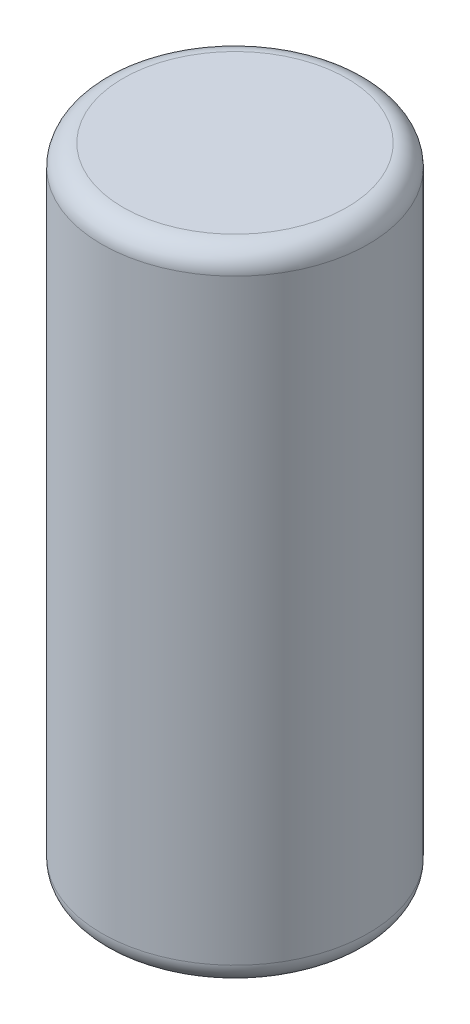
from build123d import *

# Parameters (mm, degrees)
SKETCH1_R           = 62.5
BOSS_EXTRUDE1_DEPTH = 300
FILLET3_R           = 10


with BuildPart() as part:
    # Sketch1 → Boss-Extrude1 (new body)
    with BuildSketch(Plane(origin=(0, 0, 0), x_dir=(1, 0, 0), z_dir=(0, 1, 0))):
        with Locations(Location((0, 0, 0), (0, 0, 270))):
            Circle(SKETCH1_R)
    extrude(amount=BOSS_EXTRUDE1_DEPTH)

    # Fillet3
    fillet3_edges = [part.edges().sort_by_distance(p)[0] for p in [
        (0, 0, -62.5),
        (0, 300, -62.5),
    ]]
    fillet(fillet3_edges, radius=FILLET3_R)


solid = part.part
